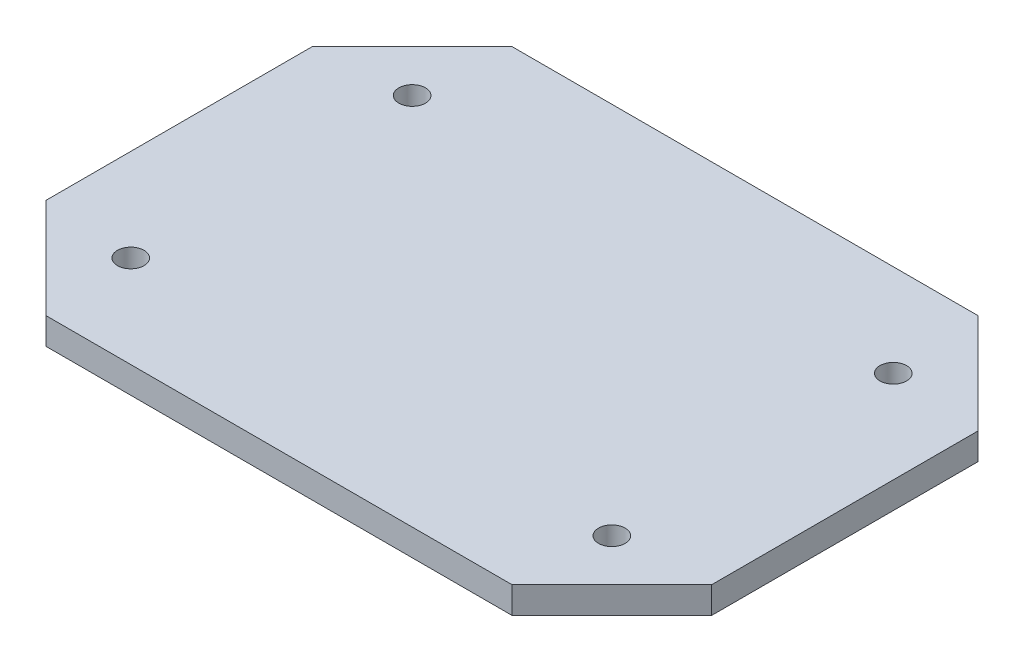
from build123d import *

# Parameters (mm, degrees)
SKETCH1_R           = 2.54
BOSS_EXTRUDE1_DEPTH = 5.08


with BuildPart() as part:
    # Sketch1 → Boss-Extrude1 (new body)
    with BuildSketch(Plane(origin=(0, 0, 0), x_dir=(1, 0, 0), z_dir=(0, 1, 0))):
        Polygon((107.95, 88.9), (19.05, 88.9), (0, 69.85), (0, 19.05), (19.05, 0), (107.95, 0), (127, 19.05), (127, 69.85), align=None)
        with Locations(Location((17.607230509, 71.292769491, 0), (0, 0, 270))):
            Circle(SKETCH1_R, mode=Mode.SUBTRACT)
        with Locations(Location((17.607230509, 17.607230509, 0), (0, 0, 90))):
            Circle(SKETCH1_R, mode=Mode.SUBTRACT)
        with Locations(Location((109.392769491, 17.607230509, 0), (0, 0, 270))):
            Circle(SKETCH1_R, mode=Mode.SUBTRACT)
        with Locations(Location((109.392769491, 71.292769491, 0), (0, 0, 90))):
            Circle(SKETCH1_R, mode=Mode.SUBTRACT)
    extrude(amount=BOSS_EXTRUDE1_DEPTH)


solid = part.part
